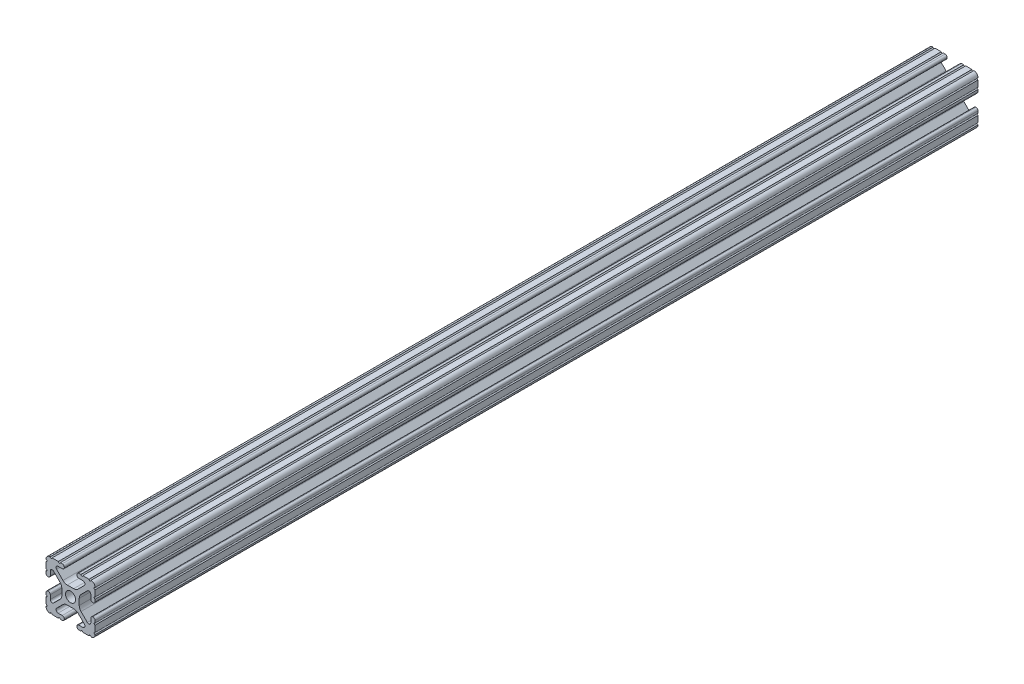
from build123d import *

# Parameters (mm, degrees)
SKETCH1_R           = 2.6035
BOSS_EXTRUDE1_DEPTH = 228.6


with BuildPart() as part:
    # Sketch1 → Boss-Extrude1 (new, symmetric)
    with BuildSketch(Plane.XY):
        with BuildLine():
            Line((-7.179650497, -8.645192506), (-3.952270251, -5.423690499))
            ThreePointArc((-3.952270251, -5.423690499), (-2.922936451, -4.736929036), (-1.709253557, -4.4958))
            Line((-1.709253557, -4.4958), (1.709253557, -4.4958))
            ThreePointArc((1.709253557, -4.4958), (2.922936451, -4.736929036), (3.952270251, -5.423690499))
            Line((3.952270251, -5.423690499), (7.179650497, -8.645192506))
            ThreePointArc((7.179650497, -8.645192506), (7.41473083, -9.822813117), (6.416408329, -10.4902))
            Line((6.416408329, -10.4902), (4.287512407, -10.4902))
            ThreePointArc((4.287512407, -10.4902), (3.54574862, -10.79744862), (3.2385, -11.539212407))
            Line((3.2385, -11.539212407), (3.2385, -11.650987593))
            ThreePointArc((3.2385, -11.650987593), (3.54574862, -12.39275138), (4.287512407, -12.7))
            Line((4.287512407, -12.7), (5.317126718, -12.7))
            ThreePointArc((5.317126718, -12.7), (5.825126718, -12.192), (6.333126718, -12.7))
            Line((6.333126718, -12.7), (9.550443118, -12.7))
            ThreePointArc((9.550443118, -12.7), (10.058366869, -12.192000006), (10.566443095, -12.699847501))
            ThreePointArc((10.566443095, -12.699847501), (12.082537762, -12.08250727), (12.699846982, -10.566399977))
            ThreePointArc((12.699846982, -10.566399977), (12.192000006, -10.058323491), (12.7, -9.5504))
            Line((12.7, -9.5504), (12.7, -6.3330836))
            ThreePointArc((12.7, -6.3330836), (12.192, -5.8250836), (12.7, -5.3170836))
            Line((12.7, -5.3170836), (12.7, -4.287469289))
            ThreePointArc((12.7, -4.287469289), (12.39275138, -3.545705502), (11.650987593, -3.238456882))
            Line((11.650987593, -3.238456882), (11.539212407, -3.238456882))
            ThreePointArc((11.539212407, -3.238456882), (10.79744862, -3.545705502), (10.4902, -4.287469289))
            Line((10.4902, -4.287469289), (10.4902, -6.402089023))
            ThreePointArc((10.4902, -6.402089023), (9.856505071, -7.351067942), (8.737131347, -7.129408934))
            Line((8.737131347, -7.129408934), (5.441005833, -3.840816462))
            ThreePointArc((5.441005833, -3.840816462), (4.750877967, -2.809883091), (4.5085, -1.593185507))
            Line((4.5085, -1.593185507), (4.5085, 1.593185507))
            ThreePointArc((4.5085, 1.593185507), (4.750877967, 2.809883091), (5.441005833, 3.840816462))
            Line((5.441005833, 3.840816462), (8.737131347, 7.129408934))
            ThreePointArc((8.737131347, 7.129408934), (9.856505071, 7.351067942), (10.4902, 6.402089023))
            Line((10.4902, 6.402089023), (10.4902, 4.287469289))
            ThreePointArc((10.4902, 4.287469289), (10.79744862, 3.545705502), (11.539212407, 3.238456882))
            Line((11.539212407, 3.238456882), (11.650987593, 3.238456882))
            ThreePointArc((11.650987593, 3.238456882), (12.39275138, 3.545705502), (12.7, 4.287469289))
            Line((12.7, 4.287469289), (12.7, 5.3170836))
            ThreePointArc((12.7, 5.3170836), (12.192, 5.8250836), (12.7, 6.3330836))
            Line((12.7, 6.3330836), (12.7, 9.5504))
            ThreePointArc((12.7, 9.5504), (12.192000006, 10.058323491), (12.699846982, 10.566399977))
            ThreePointArc((12.699846982, 10.566399977), (12.082537762, 12.08250727), (10.566443095, 12.699847501))
            ThreePointArc((10.566443095, 12.699847501), (10.058366869, 12.192000006), (9.550443118, 12.7))
            Line((9.550443118, 12.7), (6.333126718, 12.7))
            ThreePointArc((6.333126718, 12.7), (5.825126718, 12.192), (5.317126718, 12.7))
            Line((5.317126718, 12.7), (4.287512407, 12.7))
            ThreePointArc((4.287512407, 12.7), (3.54574862, 12.39275138), (3.2385, 11.650987593))
            Line((3.2385, 11.650987593), (3.2385, 11.539212407))
            ThreePointArc((3.2385, 11.539212407), (3.54574862, 10.79744862), (4.287512407, 10.4902))
            Line((4.287512407, 10.4902), (6.476788598, 10.4902))
            ThreePointArc((6.476788598, 10.4902), (7.432222385, 9.85140422), (7.207036008, 8.724370562))
            Line((7.207036008, 8.724370562), (3.898272566, 5.423169045))
            ThreePointArc((3.898272566, 5.423169045), (2.869120213, 4.736787962), (1.655778399, 4.4958))
            Line((1.655778399, 4.4958), (-1.655778399, 4.4958))
            ThreePointArc((-1.655778399, 4.4958), (-2.869120213, 4.736787962), (-3.898272566, 5.423169045))
            Line((-3.898272566, 5.423169045), (-7.207036008, 8.724370562))
            ThreePointArc((-7.207036008, 8.724370562), (-7.432222385, 9.85140422), (-6.476788598, 10.4902))
            Line((-6.476788598, 10.4902), (-4.287512407, 10.4902))
            ThreePointArc((-4.287512407, 10.4902), (-3.54574862, 10.79744862), (-3.2385, 11.539212407))
            Line((-3.2385, 11.539212407), (-3.2385, 11.650987593))
            ThreePointArc((-3.2385, 11.650987593), (-3.54574862, 12.39275138), (-4.287512407, 12.7))
            Line((-4.287512407, 12.7), (-5.317126718, 12.7))
            ThreePointArc((-5.317126718, 12.7), (-5.825126718, 12.192), (-6.333126718, 12.7))
            Line((-6.333126718, 12.7), (-9.550443118, 12.7))
            ThreePointArc((-9.550443118, 12.7), (-10.058366869, 12.192000006), (-10.566443095, 12.699847501))
            ThreePointArc((-10.566443095, 12.699847501), (-12.082537762, 12.08250727), (-12.699846982, 10.566399977))
            ThreePointArc((-12.699846982, 10.566399977), (-12.192000006, 10.058323491), (-12.7, 9.5504))
            Line((-12.7, 9.5504), (-12.7, 6.3330836))
            ThreePointArc((-12.7, 6.3330836), (-12.192, 5.8250836), (-12.7, 5.3170836))
            Line((-12.7, 5.3170836), (-12.7, 4.287469289))
            ThreePointArc((-12.7, 4.287469289), (-12.39275138, 3.545705502), (-11.650987593, 3.238456882))
            Line((-11.650987593, 3.238456882), (-11.539212407, 3.238456882))
            ThreePointArc((-11.539212407, 3.238456882), (-10.79744862, 3.545705502), (-10.4902, 4.287469289))
            Line((-10.4902, 4.287469289), (-10.4902, 6.402089023))
            ThreePointArc((-10.4902, 6.402089023), (-9.856505071, 7.351067942), (-8.737131347, 7.129408934))
            Line((-8.737131347, 7.129408934), (-5.441005833, 3.840816462))
            ThreePointArc((-5.441005833, 3.840816462), (-4.750877967, 2.809883091), (-4.5085, 1.593185507))
            Line((-4.5085, 1.593185507), (-4.5085, -1.593185507))
            ThreePointArc((-4.5085, -1.593185507), (-4.750877967, -2.809883091), (-5.441005833, -3.840816462))
            Line((-5.441005833, -3.840816462), (-8.737131347, -7.129408934))
            ThreePointArc((-8.737131347, -7.129408934), (-9.856505071, -7.351067942), (-10.4902, -6.402089023))
            Line((-10.4902, -6.402089023), (-10.4902, -4.287469289))
            ThreePointArc((-10.4902, -4.287469289), (-10.79744862, -3.545705502), (-11.539212407, -3.238456882))
            Line((-11.539212407, -3.238456882), (-11.650987593, -3.238456882))
            ThreePointArc((-11.650987593, -3.238456882), (-12.39275138, -3.545705502), (-12.7, -4.287469289))
            Line((-12.7, -4.287469289), (-12.7, -5.3170836))
            ThreePointArc((-12.7, -5.3170836), (-12.192, -5.8250836), (-12.7, -6.3330836))
            Line((-12.7, -6.3330836), (-12.7, -9.5504))
            ThreePointArc((-12.7, -9.5504), (-12.192000006, -10.058323491), (-12.699846982, -10.566399977))
            ThreePointArc((-12.699846982, -10.566399977), (-12.082537762, -12.08250727), (-10.566443095, -12.699847501))
            ThreePointArc((-10.566443095, -12.699847501), (-10.058366869, -12.192000006), (-9.550443118, -12.7))
            Line((-9.550443118, -12.7), (-6.333126718, -12.7))
            ThreePointArc((-6.333126718, -12.7), (-5.825126718, -12.192), (-5.317126718, -12.7))
            Line((-5.317126718, -12.7), (-4.287512407, -12.7))
            ThreePointArc((-4.287512407, -12.7), (-3.54574862, -12.39275138), (-3.2385, -11.650987593))
            Line((-3.2385, -11.650987593), (-3.2385, -11.539212407))
            ThreePointArc((-3.2385, -11.539212407), (-3.54574862, -10.79744862), (-4.287512407, -10.4902))
            Line((-4.287512407, -10.4902), (-6.416408329, -10.4902))
            ThreePointArc((-6.416408329, -10.4902), (-7.41473083, -9.822813117), (-7.179650497, -8.645192506))
        make_face()
        Circle(SKETCH1_R, mode=Mode.SUBTRACT)
    extrude(amount=BOSS_EXTRUDE1_DEPTH, both=True)


solid = part.part
